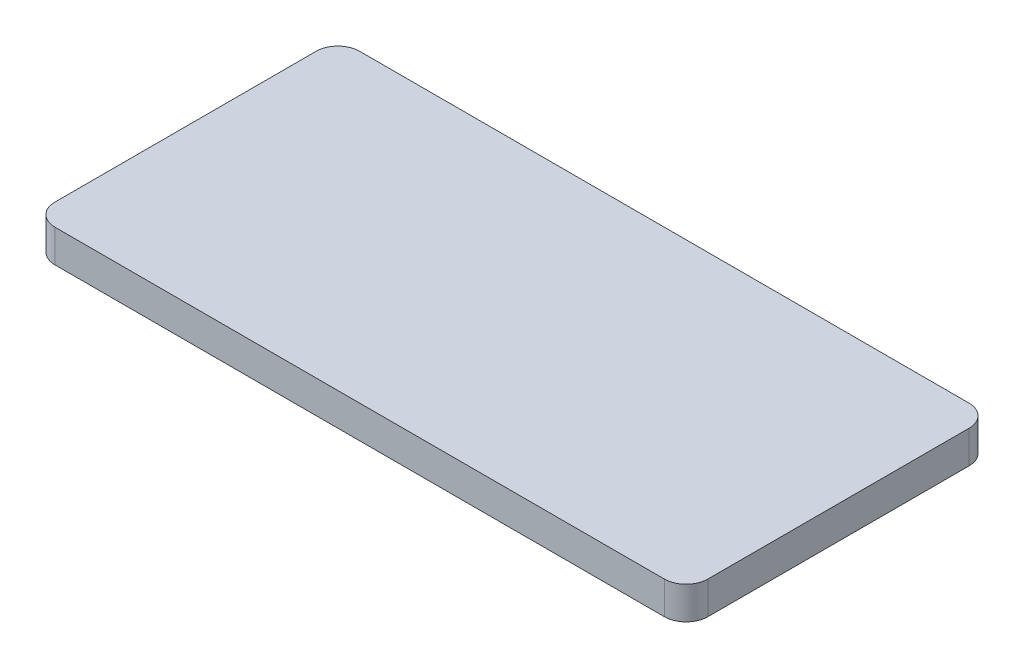
from build123d import *

# Parameters (mm, degrees)
SKETCH1_W           = 600
SKETCH1_H           = 280
BOSS_EXTRUDE1_DEPTH = 30
FILLET1_R           = 20


with BuildPart() as part:
    # Sketch1 → Boss-Extrude1 (new body)
    with BuildSketch(Plane(origin=(0, 0, 0), x_dir=(1, 0, 0), z_dir=(0, 1, 0))):
        with Locations((43.127508055, -9.350891932)):
            Rectangle(SKETCH1_W, SKETCH1_H)
    extrude(amount=BOSS_EXTRUDE1_DEPTH)

    # Fillet1
    fillet1_edges = [part.edges().sort_by_distance(p)[0] for p in [
        (343.127508055, 15, 149.350891932),
        (-256.872491945, 15, 149.350891932),
        (-256.872491945, 15, -130.649108068),
        (343.127508055, 15, -130.649108068),
    ]]
    fillet(fillet1_edges, radius=FILLET1_R)


solid = part.part
